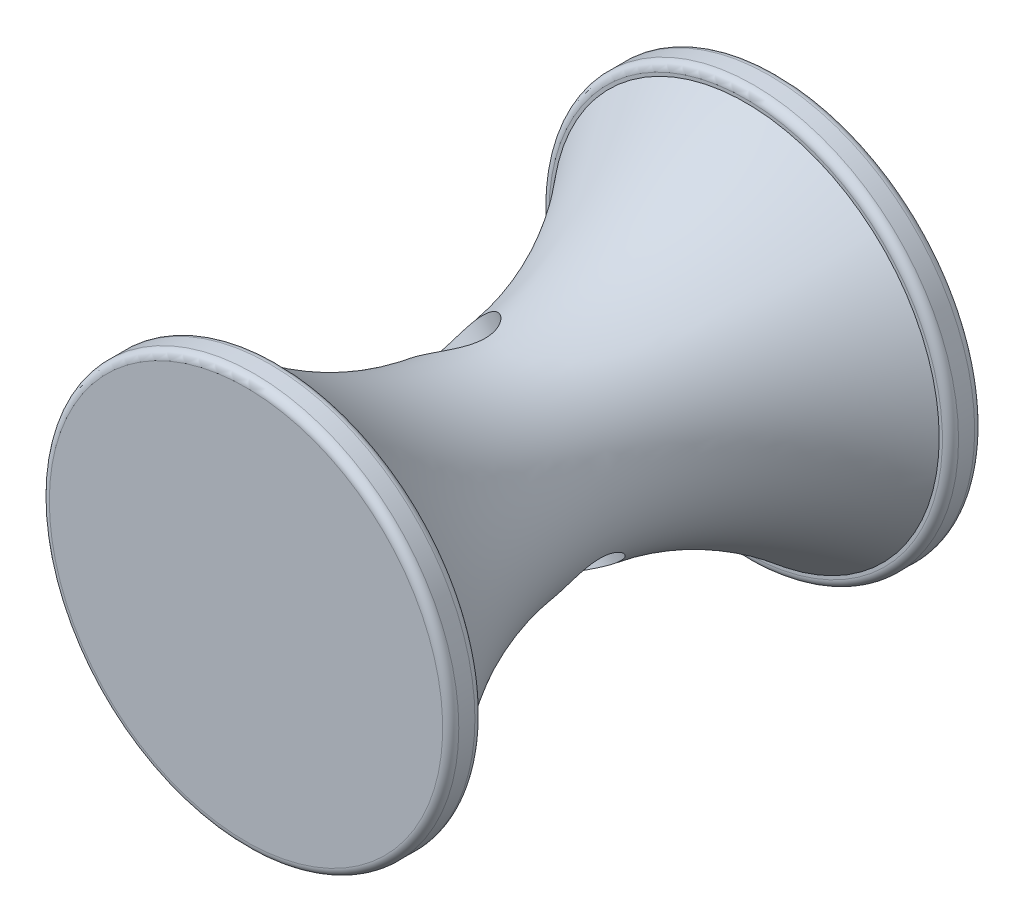
from build123d import *

# Parameters (mm, degrees)
CUT_EXTRUDE2_DEPTH             = 2
CUT_EXTRUDE2_DEPTH_BACK        = 14
SKETCH1_R                      = 2
FILLET1_R                      = 0.5
CUT_EXTRUDE4_REACH             = 37.827
SKETCH5_R                      = 2.5
CUT_EXTRUDE4_DIRECTION_2_REACH = 37.827
SKETCH6_R                      = 5
BOSS_EXTRUDE1_DEPTH            = 5
SKETCH8_R                      = 2
CUT_EXTRUDE5_DEPTH             = 5
FILLET2_R                      = 0.5
CUT_EXTRUDE6_REACH             = 37.827
CUT_EXTRUDE6_END_RADIUS        = 5
SKETCH9_R                      = 0.8


with BuildPart() as part:
    # Sketch3 → Revolve1 (revolve)
    with BuildSketch(Plane(origin=(0, 0, 0), x_dir=(0, 0, 1), z_dir=(-0.6515689673474042, 0.7585894019756916, 0)), mode=Mode.PRIVATE) as revolve1_sk:
        Polygon((-2, 0), (0, 0), (0, 12), (0, 12.7), (-2, 12.7), align=None)
        with BuildLine():
            Line((0, 12), (0, 0))
            Line((0, 0), (14.5, 0))
            Line((14.5, 0), (14.5, 6))
            add(Edge.make_bspline(
                [(0, 12), (7.25, 6), (14.5, 6)],
                knots=[0, 0, 0, 0.5, 0.5, 0.5], degree=2))
        make_face()
        with BuildLine():
            Line((14.5, 6), (14.5, 0))
            Line((14.5, 0), (29, 0))
            Line((29, 0), (29, 12))
            add(Edge.make_bspline(
                [(14.5, 6), (21.75, 6), (29, 12)],
                knots=[0.5, 0.5, 0.5, 1, 1, 1], degree=2))
        make_face()
        Polygon((29, 12), (29, 0), (31, 0), (31, 12.7), (29, 12.7), align=None)
    revolve(revolve1_sk.sketch.rotate(Axis((0, 0, 0), (0, 0, 1)), 139.34), axis=Axis((0, 0, 0), (0, 0, 1)))

    # Sketch1 → Cut-Extrude2 (cut, two sides: drawn at the far end of the back side and taken through both)
    with BuildSketch(Plane.XY.offset(-CUT_EXTRUDE2_DEPTH_BACK)):
        with Locations(Location((0, 0, 0), (0, 0, 180))):
            Circle(SKETCH1_R)
    extrude(amount=CUT_EXTRUDE2_DEPTH + CUT_EXTRUDE2_DEPTH_BACK, mode=Mode.SUBTRACT)

    # Fillet1
    fillet1_edges = [part.edges().sort_by_distance(p)[0] for p in [
        (12.7, 0, 29),
        (12.7, 0, 31),
        (12.7, 0, -2),
        (12.7, 0, 0),
    ]]
    fillet(fillet1_edges, radius=FILLET1_R)

    # Sketch5 → Cut-Extrude4 (cut, up to next)
    with BuildSketch(Plane(origin=(0, 0, 0), x_dir=(0, 0, 1), z_dir=(-0.6515689673474042, 0.7585894019756916, 0)), mode=Mode.PRIVATE) as cut_extrude4_sk1:
        with Locations(Location((14.5, 0, 0), (0, 0, 270))):
            Circle(SKETCH5_R)
    cut_extrude4_tool1 = extrude(cut_extrude4_sk1.sketch, amount=-CUT_EXTRUDE4_REACH, mode=Mode.PRIVATE) & part.part
    add(cut_extrude4_tool1.solids().sort_by_distance((0, 0, 14.5))[0], mode=Mode.SUBTRACT)

    # Sketch5 → Cut-Extrude4 direction 2 (cut, up to next)
    with BuildSketch(Plane(origin=(0, 0, 0), x_dir=(0, 0, 1), z_dir=(-0.6515689673474042, 0.7585894019756916, 0)), mode=Mode.PRIVATE) as cut_extrude4_direction_2_sk1:
        with Locations(Location((14.5, 0, 0), (0, 0, 270))):
            Circle(SKETCH5_R)
    cut_extrude4_direction_2_tool1 = extrude(cut_extrude4_direction_2_sk1.sketch, amount=CUT_EXTRUDE4_DIRECTION_2_REACH, mode=Mode.PRIVATE) & part.part
    add(cut_extrude4_direction_2_tool1.solids().sort_by_distance((0, 0, 14.5))[0], mode=Mode.SUBTRACT)

    # Sketch6 → Boss-Extrude1 (add)
    with BuildSketch(Plane(origin=(0, 0, -2), x_dir=(-1, 0, 0), z_dir=(0, 0, -1))):
        Circle(SKETCH6_R)
    extrude(amount=BOSS_EXTRUDE1_DEPTH)

    # Sketch8 → Cut-Extrude5 (cut)
    with BuildSketch(Plane(origin=(0, 0, -7), x_dir=(-1, 0, 0), z_dir=(0, 0, -1))):
        Circle(SKETCH8_R)
    extrude(amount=-CUT_EXTRUDE5_DEPTH, mode=Mode.SUBTRACT)

    # Fillet2
    fillet2_edges = [part.edges().sort_by_distance(p)[0] for p in [
        (5, 0, -2),
        (5, 0, -7),
        (2, 0, -7),
    ]]
    fillet(fillet2_edges, radius=FILLET2_R)

    # Cut-Extrude6: up to this cylinder (the profile starts inside it)
    cut_extrude6_end = Plane(origin=(0, 0, -4.5), z_dir=(0, 0, 1)) * Cylinder(CUT_EXTRUDE6_END_RADIUS, 86.654, mode=Mode.PRIVATE)
    # Sketch9 → Cut-Extrude6 (cut, up to the surface)
    with BuildSketch(Plane(origin=(0, 0, 0), x_dir=(0, 0, 1), z_dir=(-0.6515689673474042, 0.7585894019756916, 0)), mode=Mode.PRIVATE) as cut_extrude6_sk1:
        with Locations(Location((-4.5, 0, 0), (0, 0, 90))):
            Circle(SKETCH9_R)
    cut_extrude6_tool1 = extrude(cut_extrude6_sk1.sketch, amount=CUT_EXTRUDE6_REACH, mode=Mode.PRIVATE) & cut_extrude6_end
    add(cut_extrude6_tool1.solids().sort_by_distance((0, 0, -4.5))[0], mode=Mode.SUBTRACT)


solid = part.part
